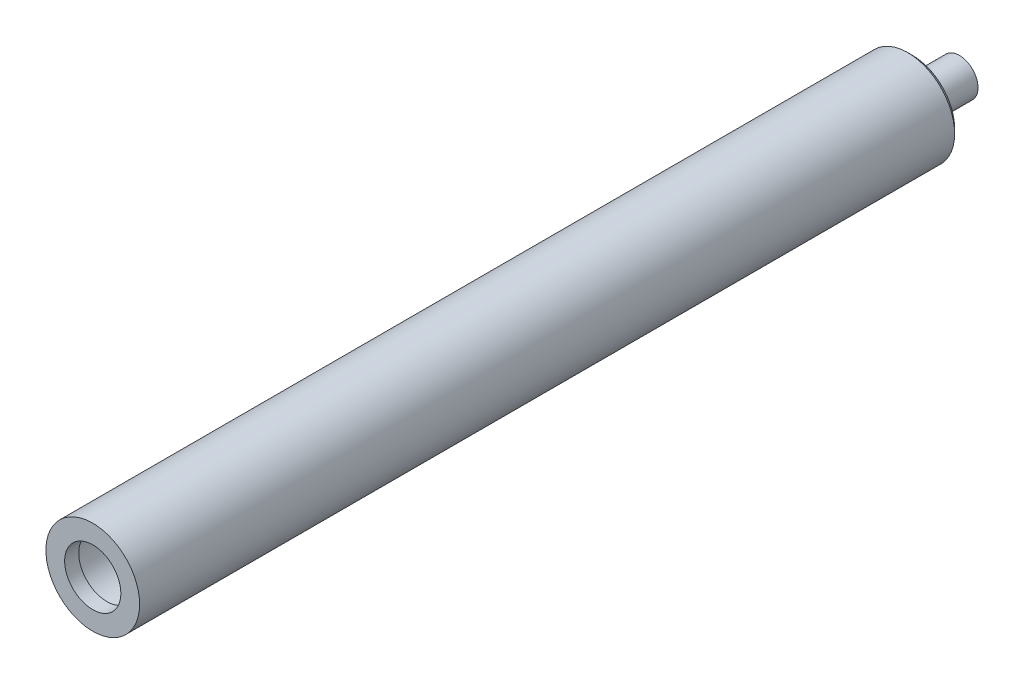
from build123d import *

# Parameters (mm, degrees)
SKETCH_1_R          = 10
EXTRUDE_1_DEPTH     = 175
SKETCH_2_R          = 7
CUT_EXTRUDE_1_DEPTH = 167
SKETCH_3_R          = 4
EXTRUDE_2_DEPTH     = 10
CHAMFER_1_SIZE      = 1
SKETCH_4_R          = 7
SKETCH_4_R_2        = 6
EXTRUDE_3_DEPTH     = 3


with BuildPart() as part:
    # 草图1 → 凸台-拉伸1 (new body)
    with BuildSketch(Plane.XY):
        Circle(SKETCH_1_R)
    extrude(amount=EXTRUDE_1_DEPTH)

    # 草图2 → 切除-拉伸1 (cut)
    with BuildSketch(Plane.XY.offset(175)):
        Circle(SKETCH_2_R)
    extrude(amount=-CUT_EXTRUDE_1_DEPTH, mode=Mode.SUBTRACT)

    # 草图3 → 凸台-拉伸2 (add)
    with BuildSketch(Plane(origin=(0, 0, 0), x_dir=(-1, 0, 0), z_dir=(0, 0, -1))):
        Circle(SKETCH_3_R)
    extrude(amount=EXTRUDE_2_DEPTH)

    # 倒角1
    chamfer_1_edges = [part.edges().sort_by_distance(p)[0] for p in [
        (-10, 0, 0),
    ]]
    chamfer(chamfer_1_edges, length=CHAMFER_1_SIZE)

    # 草图4 → 凸台-拉伸3 (add)
    with BuildSketch(Plane.XY.offset(175)):
        Circle(SKETCH_4_R)
        Circle(SKETCH_4_R_2, mode=Mode.SUBTRACT)
    extrude(amount=-EXTRUDE_3_DEPTH)


solid = part.part
